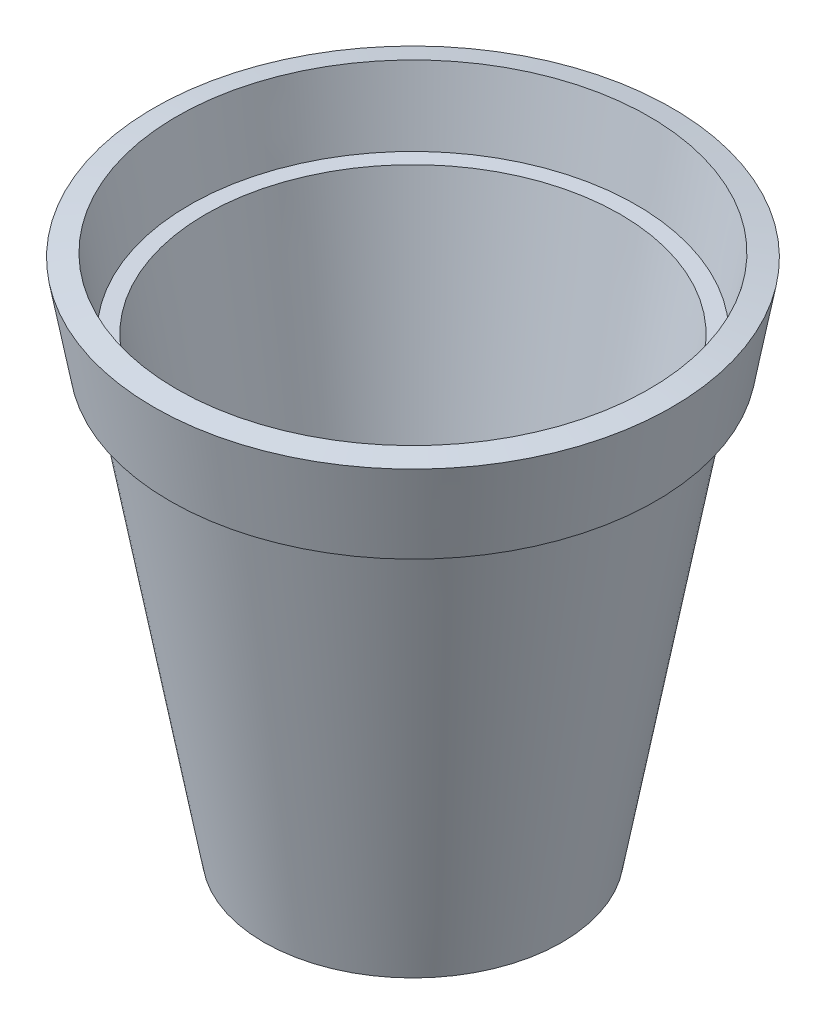
from build123d import *


with BuildPart() as part:
    # Sketch1 → Revolve1 (revolve)
    with BuildSketch(Plane.XY, mode=Mode.PRIVATE) as revolve1_sk:
        Polygon((0, 0), (46, 0), (70, 132.48), (75, 132.48), (80, 160.08), (72.915316675, 161.363457124), (68.987154153, 139.68), (63.987154153, 139.68), (39.987154153, 7.2), (0, 7.2), align=None)
    revolve(revolve1_sk.sketch.rotate(Axis((0, 7.2, 0), (0, -1, 0)), 90), axis=Axis((0, 7.2, 0), (0, -1, 0)))


solid = part.part
